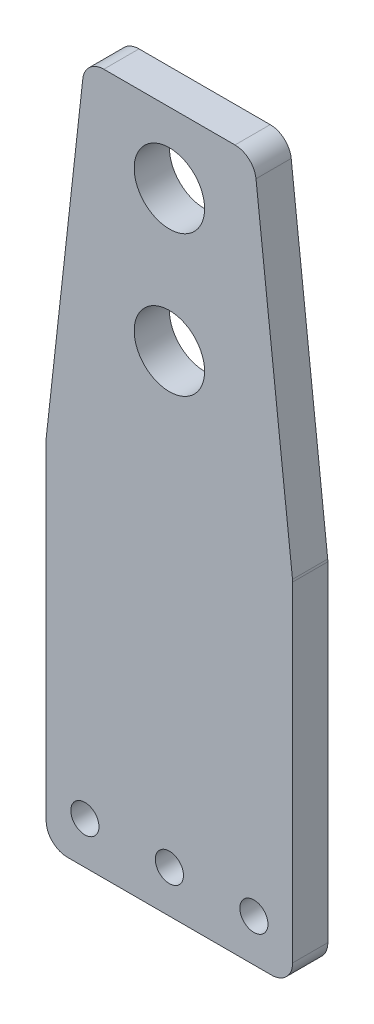
from build123d import *

# Parameters (mm, degrees)
EXTRUDE_1_DEPTH         = 5
FILLET_1_R              = 3
SKETCH_2_R              = 2
SKETCH_2_R_2            = 4.5
CUT_EXTRUDE_1_DEPTH     = 106.594744187
HOLE_WIZARD_M10_5_D     = 10
HOLE_WIZARD_M10_5_DEPTH = 24.5


with BuildPart() as part:
    # 草图1 → 凸台-拉伸1 (new body)
    with BuildSketch(Plane.XY):
        Polygon((-35, 0), (0, 0), (0, 50), (-5.5, 99.5), (-29.5, 99.5), (-35, 50), align=None)
    extrude(amount=EXTRUDE_1_DEPTH)

    # 圆角1
    fillet_1_edges = [part.edges().sort_by_distance(p)[0] for p in [
        (-35, 50, 2.5),
        (-29.5, 99.5, 2.5),
        (-5.5, 99.5, 2.5),
        (0, 50, 2.5),
        (0, 0, 2.5),
        (-35, 0, 2.5),
    ]]
    fillet(fillet_1_edges, radius=FILLET_1_R)

    # 草图2 → 切除-拉伸1 (cut, through all)
    with BuildSketch(Plane.XY.offset(5)):
        with Locations((-29.5, 6)):
            Circle(SKETCH_2_R)
        with Locations((-17.5, 6)):
            Circle(SKETCH_2_R)
        with Locations((-5.5, 6)):
            Circle(SKETCH_2_R)
        with Locations((-17.5, 89.5)):
            Circle(SKETCH_2_R_2)
        with Locations((-17.5, 69.5)):
            Circle(SKETCH_2_R_2)
    extrude(amount=-CUT_EXTRUDE_1_DEPTH, mode=Mode.SUBTRACT)

    # M10 螺纹孔5
    with Locations(Plane.XY.offset(5)):
        with Locations((-17.5, 69.5), (-17.5, 89.5)):
            Hole(HOLE_WIZARD_M10_5_D / 2, depth=HOLE_WIZARD_M10_5_DEPTH)


solid = part.part
